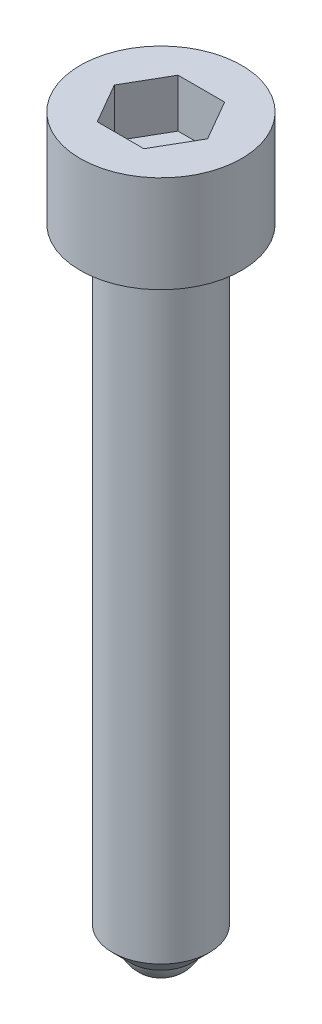
from build123d import *

# Parameters (mm, degrees)
CUT_EXTRUDE1_DEPTH = 3


with BuildPart() as part:
    # Sketch1 → Revolve1 (revolve)
    with BuildSketch(Plane.XY, mode=Mode.PRIVATE) as revolve1_sk:
        with BuildLine():
            Line((3, -37.5734994), (3, 0))
            Line((3, 0), (5, 0))
            Line((5, 0), (5, 6))
            Line((5, 6), (0, 6))
            Line((0, 6), (0, -40))
            ThreePointArc((0, -40), (1.140175425, -39.643167673), (1.8734994, -38.7))
            Line((1.8734994, -38.7), (3, -37.5734994))
        make_face()
    revolve(revolve1_sk.sketch.rotate(Axis((0, 61.691642626, 0), (0, -1, 0)), 90), axis=Axis((0, 61.691642626, 0), (0, -1, 0)))

    # Sketch2 → Cut-Extrude1 (cut)
    with BuildSketch(Plane(origin=(0, 6, 0), x_dir=(-1, 0, 0), z_dir=(0, 1, 0))):
        Polygon((-1.443375673, -2.5), (1.443375673, -2.5), (2.886751346, 0), (1.443375673, 2.5), (-1.443375673, 2.5), (-2.886751346, 0), align=None)
    extrude(amount=-CUT_EXTRUDE1_DEPTH, mode=Mode.SUBTRACT)


solid = part.part
